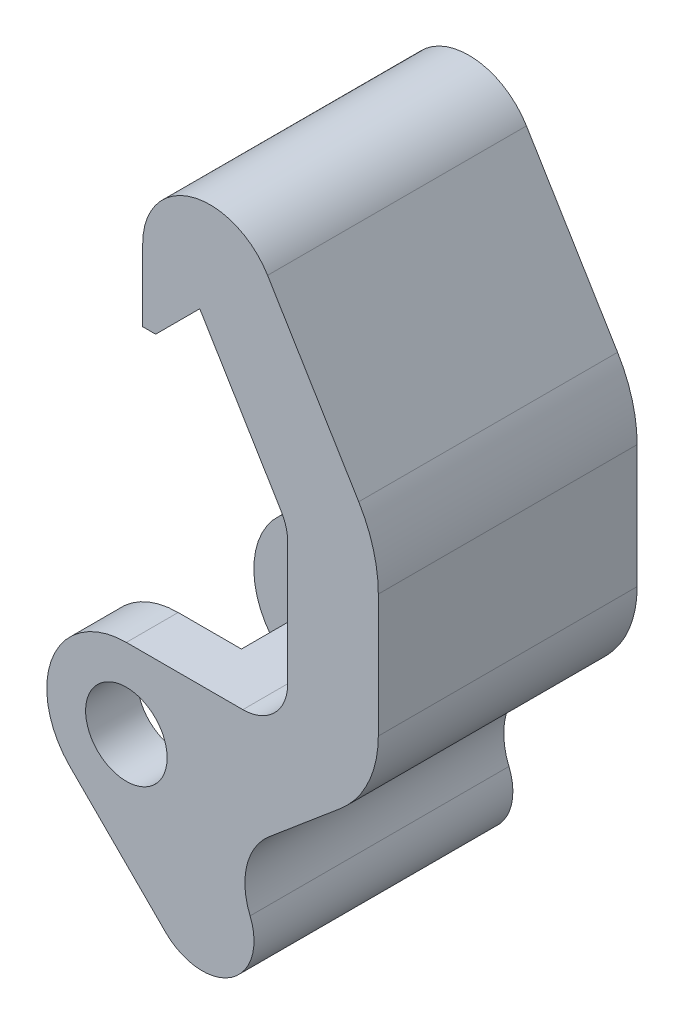
from build123d import *

# Parameters (mm, degrees)
SKETCH1_R           = 1.575
BOSS_EXTRUDE1_DEPTH = 5
SKETCH2_R           = 3.928649494
CUT_EXTRUDE1_DEPTH  = 3


with BuildPart() as part:
    # Sketch1 → Boss-Extrude1 (new, symmetric)
    with BuildSketch(Plane.XY):
        with BuildLine():
            Line((9.732479224, 4.807479224), (9.732479224, 9.557479224))
            ThreePointArc((9.732479224, 9.557479224), (9.539846423, 10.964172818), (8.976131504, 12.267292058))
            Line((8.976131504, 12.267292058), (5.455637648, 18.08252522))
            ThreePointArc((5.455637648, 18.08252522), (2.532334022, 19.240369543), (0.631218006, 16.735960338))
            Line((0.631218006, 16.735960338), (0.631218006, 13.950074632))
            Line((0.631218006, 13.950074632), (1.131218006, 13.950074632))
            Line((1.131218006, 13.950074632), (2.83470481, 15.653561435))
            Line((2.83470481, 15.653561435), (5.98205172, 10.454701026))
            ThreePointArc((5.98205172, 10.454701026), (6.168698307, 10.023236912), (6.232479224, 9.557479224))
            Line((6.232479224, 9.557479224), (6.232479224, 4.807479224))
            ThreePointArc((6.232479224, 4.807479224), (5.725047808, 3.582431417), (4.5, 3.075))
            Line((4.5, 3.075), (0, 3.075))
            ThreePointArc((0, 3.075), (-2.840929562, 1.176751555), (-2.174353352, -2.174353352))
            Line((-2.174353352, -2.174353352), (1.517126313, -5.865833018))
            ThreePointArc((1.517126313, -5.865833018), (4.042707088, -6.11440715), (4.778890142, -3.685748701))
            ThreePointArc((4.778890142, -3.685748701), (4.653279573, -2.058204966), (5.513269646, -0.670727508))
            Line((5.513269646, -0.670727508), (8.260484532, 1.643135904))
            ThreePointArc((8.260484532, 1.643135904), (9.346473058, 3.062498062), (9.732479224, 4.807479224))
        make_face()
        Circle(SKETCH1_R, mode=Mode.SUBTRACT)
    extrude(amount=BOSS_EXTRUDE1_DEPTH, both=True)

    # Sketch2 → Cut-Extrude1 (cut, symmetric)
    with BuildSketch(Plane.XY):
        Circle(SKETCH2_R)
    extrude(amount=CUT_EXTRUDE1_DEPTH, both=True, mode=Mode.SUBTRACT)


solid = part.part
